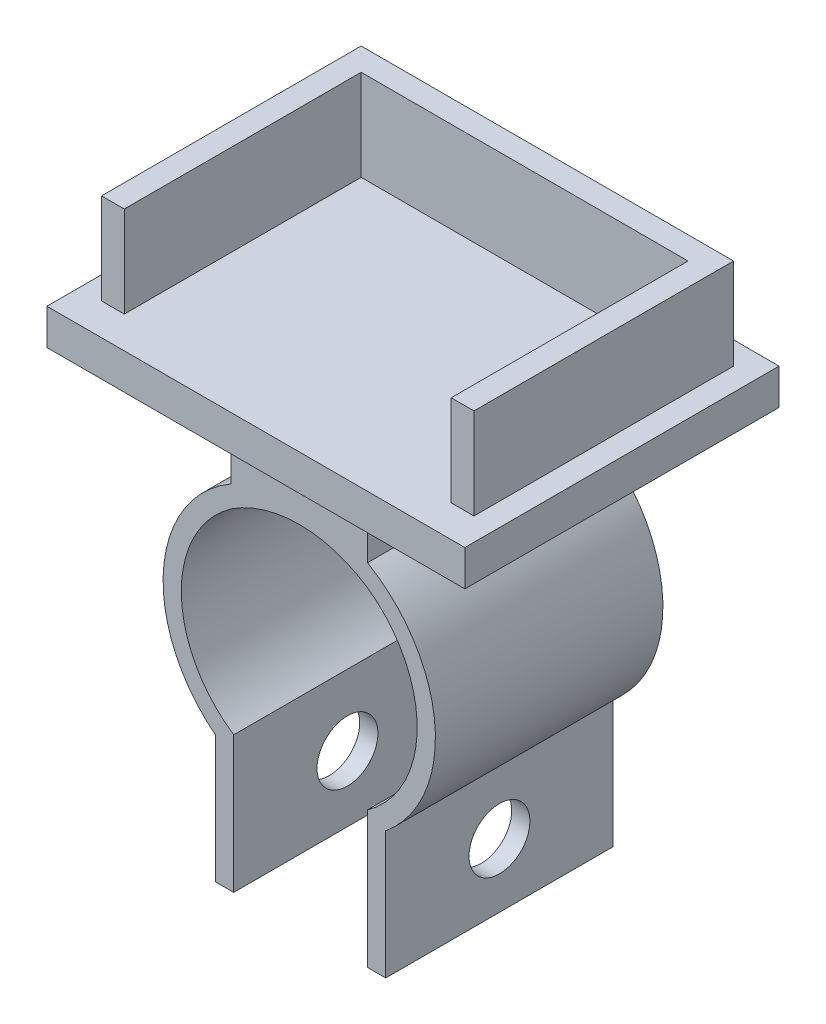
from build123d import *

# Parameters (mm, degrees)
SKETCH1_W           = 23.330000076
SKETCH1_H           = 17.539999972
BOSS_EXTRUDE1_DEPTH = 2
BOSS_EXTRUDE2_DEPTH = 5.08
SKETCH3_W           = 7.62
SKETCH3_H           = 12.7
BOSS_EXTRUDE3_DEPTH = 5.08
SKETCH4_R           = 6.858
CUT_EXTRUDE2_DEPTH  = 29.688494264
BOSS_EXTRUDE4_DEPTH = 12.7
SKETCH6_R           = 1.7
CUT_EXTRUDE3_DEPTH  = 34.67462964


with BuildPart() as part:
    # Sketch1 → Boss-Extrude1 (new body)
    with BuildSketch(Plane(origin=(0, 0, 0), x_dir=(1, 0, 0), z_dir=(0, 1, 0))):
        with Locations((11.665000038, 8.769999986)):
            Rectangle(SKETCH1_W, SKETCH1_H)
    extrude(amount=BOSS_EXTRUDE1_DEPTH)

    # Sketch2 → Boss-Extrude2 (add)
    with BuildSketch(Plane(origin=(0, 2, 0), x_dir=(1, 0, 0), z_dir=(0, 1, 0))):
        Polygon((1.27, 1.778), (1.27, 16.269999972), (22.060000076, 16.269999972), (22.060000076, 1.778), (20.790000076, 1.778), (20.790000076, 14.999999972), (2.54, 14.999999972), (2.54, 1.778), align=None)
    extrude(amount=BOSS_EXTRUDE2_DEPTH)

    # Sketch3 → Boss-Extrude3 (add)
    with BuildSketch(Plane.XZ):
        with Locations((11.665000038, -8.769999986)):
            Rectangle(SKETCH3_W, SKETCH3_H)
    extrude(amount=BOSS_EXTRUDE3_DEPTH)

    # Sketch4 → Cut-Extrude2 (cut, through all)
    with BuildSketch(Plane.XY.offset(-2.419999986)):
        with Locations((11.665000038, -10.782285857)):
            Circle(SKETCH4_R)
    extrude(amount=-CUT_EXTRUDE2_DEPTH, mode=Mode.SUBTRACT)

    # Sketch5 → Boss-Extrude4 (add)
    with BuildSketch(Plane.XY.offset(-2.419999986)):
        with BuildLine():
            ThreePointArc((15.475000038, -5.08), (18.249533344, -10.450286665), (15.475000038, -15.820573329))
            Line((15.475000038, -15.820573329), (15.475000038, -17.026912436))
            Line((15.475000038, -17.026912436), (15.475000038, -23.440573329))
            Line((15.475000038, -23.440573329), (16.491000038, -23.440573329))
            Line((16.491000038, -23.440573329), (16.491000038, -16.322069234))
            ThreePointArc((16.491000038, -16.322069234), (19.240344357, -9.832010848), (15.475000038, -3.873660893))
            Line((15.475000038, -3.873660893), (15.475000038, -5.08))
        make_face()
        with BuildLine():
            ThreePointArc((8.006925979, -15.925190594), (5.081112714, -10.542517711), (7.855000038, -5.08))
            Line((7.855000038, -5.08), (7.855000038, -3.873660893))
            ThreePointArc((7.855000038, -3.873660893), (4.08236068, -9.929050728), (6.990925979, -16.443711247))
            Line((6.990925979, -16.443711247), (6.990925979, -23.545190594))
            Line((6.990925979, -23.545190594), (8.006925979, -23.545190594))
            Line((8.006925979, -23.545190594), (8.006925979, -17.112613639))
            Line((8.006925979, -17.112613639), (8.006925979, -15.925190594))
        make_face()
    extrude(amount=-BOSS_EXTRUDE4_DEPTH)

    # Sketch6 → Cut-Extrude3 (cut, through all)
    with BuildSketch(Plane(origin=(16.491000038, 0, 0), x_dir=(0, 0, -1), z_dir=(1, 0, 0))):
        with Locations(Location((8.769999986, -19.881321281, 0), (0, 0, 270))):
            Circle(SKETCH6_R)
    extrude(amount=-CUT_EXTRUDE3_DEPTH, mode=Mode.SUBTRACT)


solid = part.part
